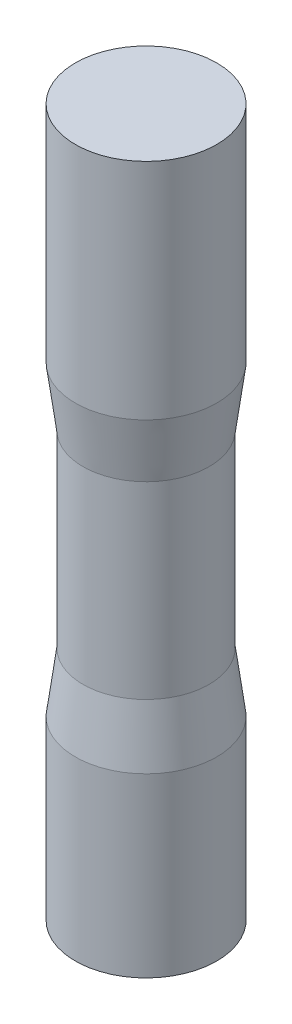
from build123d import *


with BuildPart() as part:
    # 草图1 → 旋转1 (revolve)
    with BuildSketch(Plane.XY, mode=Mode.PRIVATE) as revolve_1_sk:
        Polygon((0, 0), (-3, 0), (-3, -9.5), (-2.675, -12), (-2.675, -20), (-3, -22.5), (-3, -30), (0, -30), align=None)
    revolve(revolve_1_sk.sketch.rotate(Axis((0, -30, 0), (0, 1, 0)), 270), axis=Axis((0, -30, 0), (0, 1, 0)))


solid = part.part
